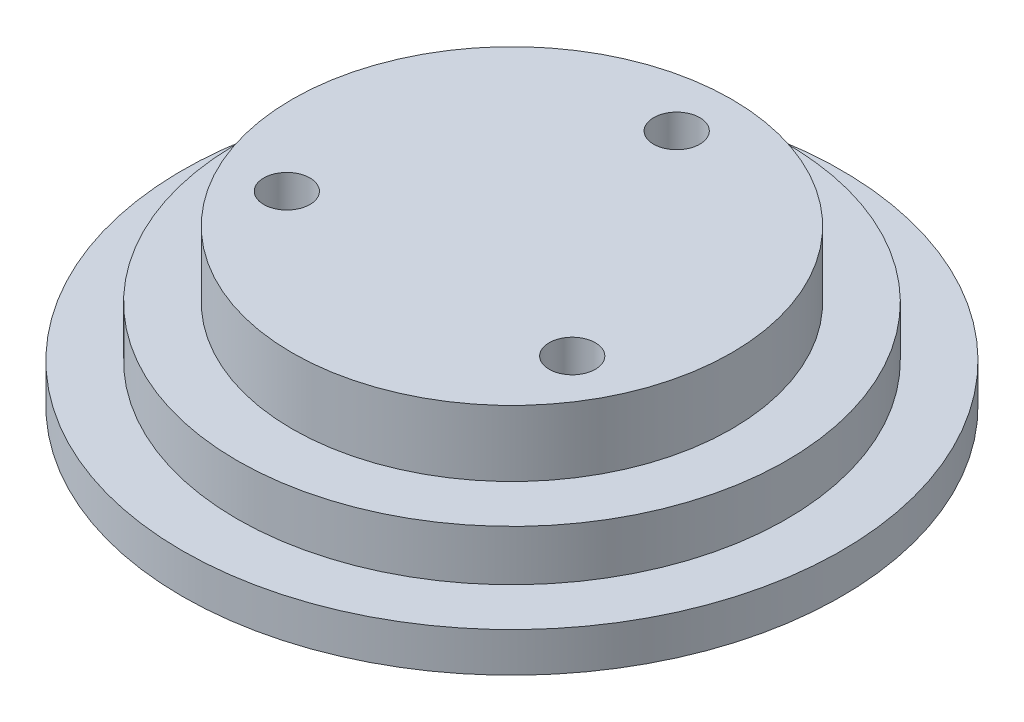
from build123d import *

# Parameters (mm, degrees)
SKETCH1_R           = 30
BOSS_EXTRUDE1_DEPTH = 3.6
SKETCH2_R           = 25
BOSS_EXTRUDE2_DEPTH = 4.6
SKETCH3_R           = 20
BOSS_EXTRUDE3_DEPTH = 6
CUT_EXTRUDE1_REACH  = 46.74
SKETCH4_R           = 2.1
CHAMFER1_SIZE       = 2


with BuildPart() as part:
    # Sketch1 → Boss-Extrude1 (new body)
    with BuildSketch(Plane(origin=(0, 0, 0), x_dir=(1, 0, 0), z_dir=(0, 1, 0))):
        with Locations(Location((0, 0, 0), (0, 0, 270))):
            Circle(SKETCH1_R)
    extrude(amount=BOSS_EXTRUDE1_DEPTH)

    # Sketch2 → Boss-Extrude2 (add)
    with BuildSketch(Plane(origin=(0, 3.6, 0), x_dir=(1, 0, 0), z_dir=(0, 1, 0))):
        with Locations(Location((0, 0, 0), (0, 0, 270))):
            Circle(SKETCH2_R)
    extrude(amount=BOSS_EXTRUDE2_DEPTH)

    # Sketch3 → Boss-Extrude3 (add)
    with BuildSketch(Plane(origin=(0, 8.2, 0), x_dir=(1, 0, 0), z_dir=(0, 1, 0))):
        with Locations(Location((0, 0, 0), (0, 0, 270))):
            Circle(SKETCH3_R)
    extrude(amount=BOSS_EXTRUDE3_DEPTH)

    # Sketch4 → Cut-Extrude1 (cut, up to next)
    with BuildSketch(Plane(origin=(0, 14.2, 0), x_dir=(1, 0, 0), z_dir=(0, 1, 0)), mode=Mode.PRIVATE) as cut_extrude1_sk1:
        with Locations(Location((0, 15, 0), (0, 0, 270))):
            Circle(SKETCH4_R)
    cut_extrude1_tool1 = extrude(cut_extrude1_sk1.sketch, amount=-CUT_EXTRUDE1_REACH, mode=Mode.PRIVATE) & part.part
    # Sketch4 → Cut-Extrude1 (cut, up to next)
    with BuildSketch(Plane(origin=(0, 14.2, 0), x_dir=(1, 0, 0), z_dir=(0, 1, 0)), mode=Mode.PRIVATE) as cut_extrude1_sk2:
        with Locations(Location((12.990381057, -7.5, 0), (0, 0, 270))):
            Circle(SKETCH4_R)
    cut_extrude1_tool2 = extrude(cut_extrude1_sk2.sketch, amount=-CUT_EXTRUDE1_REACH, mode=Mode.PRIVATE) & part.part
    # Sketch4 → Cut-Extrude1 (cut, up to next)
    with BuildSketch(Plane(origin=(0, 14.2, 0), x_dir=(1, 0, 0), z_dir=(0, 1, 0)), mode=Mode.PRIVATE) as cut_extrude1_sk3:
        with Locations(Location((-12.990381057, -7.5, 0), (0, 0, 270))):
            Circle(SKETCH4_R)
    cut_extrude1_tool3 = extrude(cut_extrude1_sk3.sketch, amount=-CUT_EXTRUDE1_REACH, mode=Mode.PRIVATE) & part.part
    add(cut_extrude1_tool1.solids().sort_by_distance((0, 14.2, -15))[0], mode=Mode.SUBTRACT)
    add(cut_extrude1_tool2.solids().sort_by_distance((12.990381, 14.2, 7.5))[0], mode=Mode.SUBTRACT)
    add(cut_extrude1_tool3.solids().sort_by_distance((-12.990381, 14.2, 7.5))[0], mode=Mode.SUBTRACT)

    # Chamfer1
    chamfer1_edges = [part.edges().sort_by_distance(p)[0] for p in [
        (0, 0, -17.1),
        (12.990381057, 0, 5.4),
        (-12.990381057, 0, 5.4),
    ]]
    chamfer(chamfer1_edges, length=CHAMFER1_SIZE)


solid = part.part
